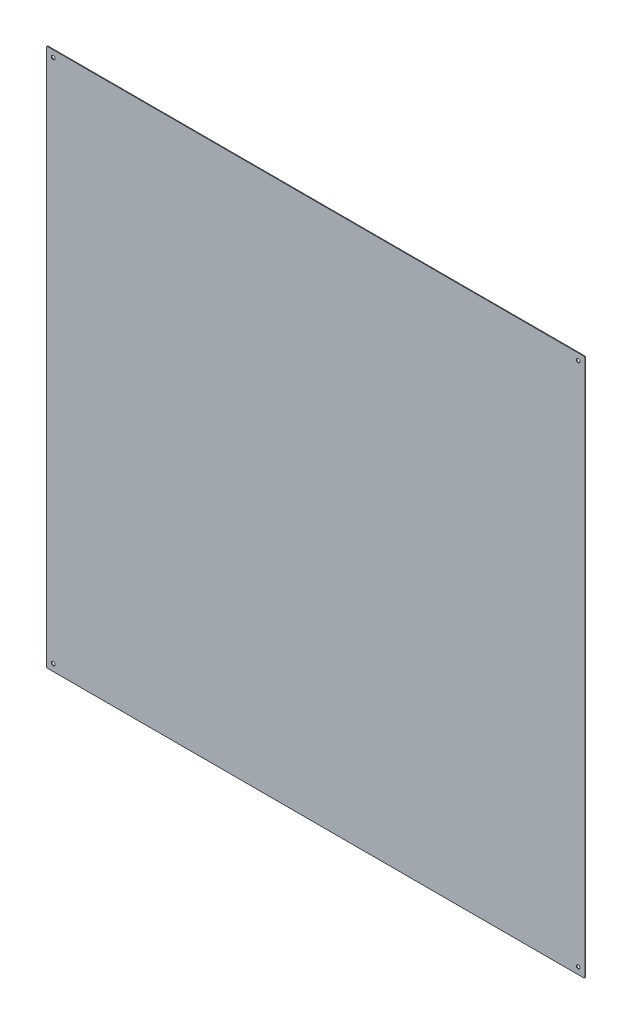
from build123d import *

# Parameters (mm, degrees)
SKETCH1_W           = 1205
SKETCH1_H           = 1205
BOSS_EXTRUDE1_DEPTH = 1.5
FILLET1_R           = 3
SKETCH2_R           = 4
CUT_EXTRUDE1_DEPTH  = 853.064991653


with BuildPart() as part:
    # Sketch1 → Boss-Extrude1 (new body)
    with BuildSketch(Plane.XY.offset(6)):
        Rectangle(SKETCH1_W, SKETCH1_H)
    extrude(amount=BOSS_EXTRUDE1_DEPTH)

    # Fillet1
    fillet1_edges = [part.edges().sort_by_distance(p)[0] for p in [
        (602.5, -602.5, 6.75),
        (-602.5, -602.5, 6.75),
        (-602.5, 602.5, 6.75),
        (602.5, 602.5, 6.75),
    ]]
    fillet(fillet1_edges, radius=FILLET1_R)

    # Sketch2 → Cut-Extrude1 (cut, through all)
    with BuildSketch(Plane(origin=(0, 0, 6), x_dir=(-1, 0, 0), z_dir=(0, 0, -1))):
        with Locations((587.32233047, -587.32233047)):
            Circle(SKETCH2_R)
        with Locations((-587.32233047, -587.32233047)):
            Circle(SKETCH2_R)
        with Locations((-587.32233047, 587.32233047)):
            Circle(SKETCH2_R)
        with Locations((587.32233047, 587.32233047)):
            Circle(SKETCH2_R)
    extrude(amount=-CUT_EXTRUDE1_DEPTH, mode=Mode.SUBTRACT)


solid = part.part
